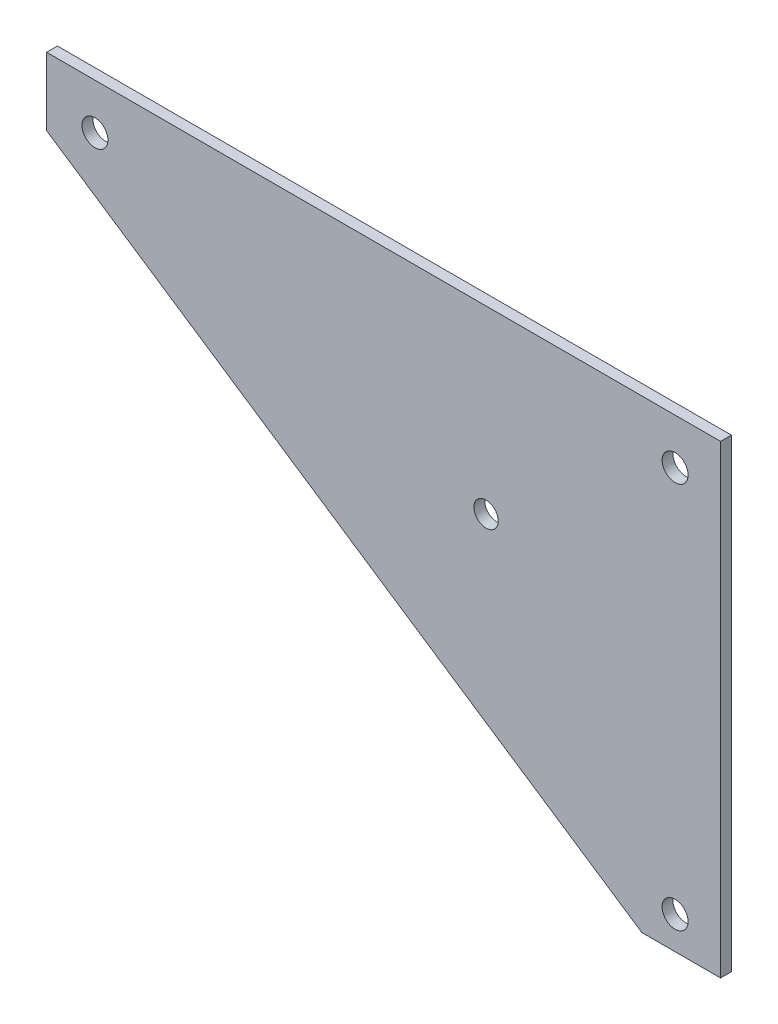
from build123d import *

# Parameters (mm, degrees)
SKETCH1_R           = 4.8
SKETCH1_R_2         = 1.5
SKETCH1_R_3         = 4.5
BOSS_EXTRUDE1_DEPTH = 4


with BuildPart() as part:
    # Sketch1 → Boss-Extrude1 (new body)
    # profile 1 of 5: a face of its own
    with BuildSketch(Plane.XY):
        Polygon((-125, 88.228571429), (-125, 63.142246191), (94.856226429, -83.428571429), (123.942857143, -83.428571429), (123.942857143, 88.228571429), align=None)
        with Locations((107.142857143, -71.428571429)):
            Circle(SKETCH1_R, mode=Mode.SUBTRACT)
        with Locations((-107.142857143, 71.428571429)):
            Circle(SKETCH1_R, mode=Mode.SUBTRACT)
        with Locations((21.832408692, 6.152026506)):
            Circle(SKETCH1_R_2, mode=Mode.SUBTRACT)
        with Locations((37.332408692, 21.652026506)):
            Circle(SKETCH1_R_3, mode=Mode.SUBTRACT)
        with Locations((52.832408692, 6.152026506)):
            Circle(SKETCH1_R_2, mode=Mode.SUBTRACT)
        with Locations((21.832408692, 37.152026506)):
            Circle(SKETCH1_R_2, mode=Mode.SUBTRACT)
        with Locations((52.832408692, 37.152026506)):
            Circle(SKETCH1_R_2, mode=Mode.SUBTRACT)
        with Locations((107.142857143, 71.428571429)):
            Circle(SKETCH1_R, mode=Mode.SUBTRACT)
    # profile 2 of 5: a face of its own
    with BuildSketch(Plane.XY):
        with Locations((21.832408692, 6.152026506)):
            Circle(SKETCH1_R_2)
    # profile 3 of 5: a face of its own
    with BuildSketch(Plane.XY):
        with Locations((21.832408692, 37.152026506)):
            Circle(SKETCH1_R_2)
    # profile 4 of 5: a face of its own
    with BuildSketch(Plane.XY):
        with Locations((52.832408692, 37.152026506)):
            Circle(SKETCH1_R_2)
    # profile 5 of 5: a face of its own
    with BuildSketch(Plane.XY):
        with Locations((52.832408692, 6.152026506)):
            Circle(SKETCH1_R_2)
    extrude(amount=BOSS_EXTRUDE1_DEPTH)


solid = part.part
